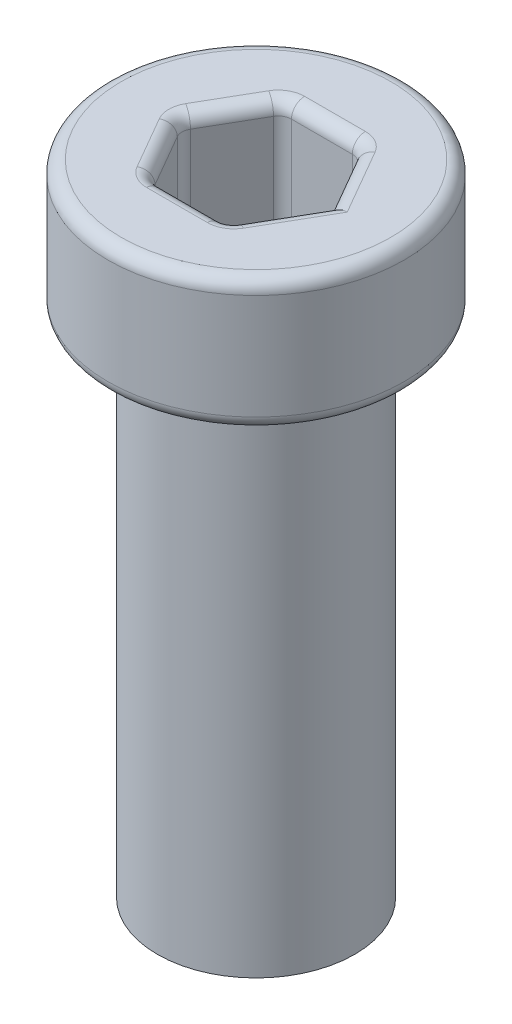
from build123d import *

# Parameters (mm, degrees)
HEAD_SKETCH_R                  = 2.25
HEAD_DEPTH                     = 2
THREADED_SECTION_STUB_SKETCH_R = 1.5
THREADED_SECTION_DEPTH         = 8
END_OF_BOLT_CHAMFER_SIZE       = 0.5
END_OF_BOLT_CHAMFER_SIZE2      = 0.288675135
COSMETIC_FILLETS_R             = 0.2


with BuildPart() as part:
    # Head Sketch → Head (new body)
    with BuildSketch(Plane(origin=(0, 0, 0), x_dir=(1, 0, 0), z_dir=(0, 1, 0))):
        with Locations(Location((0, 0, 0), (0, 0, 270))):
            Circle(HEAD_SKETCH_R)
        Polygon((-0.577350269, 1), (-1.154700538, 0), (-0.577350269, -1), (0.577350269, -1), (1.154700538, 0), (0.577350269, 1), align=None, mode=Mode.SUBTRACT)
    extrude(amount=HEAD_DEPTH)

    # Threaded Section Stub Sketch → Threaded Section (add)
    with BuildSketch(Plane(origin=(0, 0, 0), x_dir=(1, 0, 0), z_dir=(0, 1, 0))):
        with Locations(Location((0, 0, 0), (0, 0, 270))):
            Circle(THREADED_SECTION_STUB_SKETCH_R)
    extrude(amount=-THREADED_SECTION_DEPTH)

    # End Of Bolt chamfer
    end_of_bolt_chamfer_edges = [part.edges().sort_by_distance(p)[0] for p in [
        (0, -8, -1.5),
    ]]
    end_of_bolt_chamfer_side = [part.faces().sort_by_distance(p)[0] for p in [
        (0, -8, 0),
    ]]
    chamfer(end_of_bolt_chamfer_edges, length=END_OF_BOLT_CHAMFER_SIZE, length2=END_OF_BOLT_CHAMFER_SIZE2, reference=end_of_bolt_chamfer_side[0])

    # Cosmetic Fillets
    cosmetic_fillets_edges = [part.edges().sort_by_distance(p)[0] for p in [
        (-0.577350269, 1, -1),
        (-0.8660254037844384, 0, 0.5000000000000003),
        (-1.154700538, 1, 0),
        (0, 0, 1),
        (-0.577350269, 1, 1),
        (0.8660254037844388, 0, 0.4999999999999998),
        (0.577350269, 1, 1),
        (0.8660254037844388, 0, -0.5000000000000002),
        (0, 2, -1),
        (-0.866025404, 2, -0.5),
        (-0.866025404, 2, 0.5),
        (0, 2, 1),
        (0.866025404, 2, 0.5),
        (0.866025404, 2, -0.5),
        (0, 0, -2.25),
        (0, 2, -2.25),
        (0, 0, -1),
        (0.577350269, 1, -1),
        (-0.8660254037844386, 0, -0.4999999999999998),
    ]]
    fillet(cosmetic_fillets_edges, radius=COSMETIC_FILLETS_R)


solid = part.part
